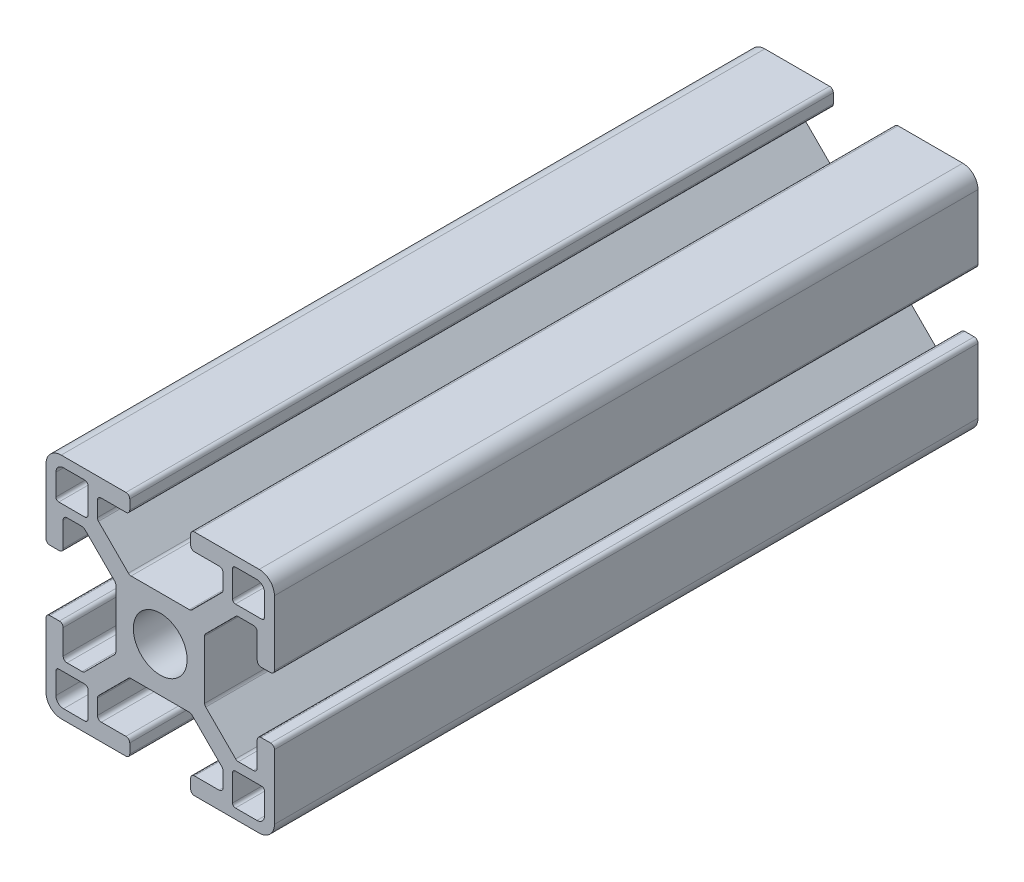
from build123d import *

# Parameters (mm, degrees)
SKETCH1_R           = 3.52998588
BOSS_EXTRUDE1_DEPTH = 46.2


with BuildPart() as part:
    # Sketch1 → Boss-Extrude1 (new, symmetric)
    with BuildSketch(Plane.XY):
        with BuildLine():
            Line((14.49994, -4), (13.24247465, -4))
            ThreePointArc((13.24247465, -4), (12.88892126, -4.146446609), (12.74247465, -4.5))
            Line((12.74247465, -4.5), (12.74247465, -7.732519321))
            ThreePointArc((12.74247465, -7.732519321), (12.602449697, -8.097296796), (12.242781236, -8.249967))
            Line((12.242781236, -8.249967), (10.260188032, -8.249967))
            ThreePointArc((10.260188032, -8.249967), (10.068847082, -8.211906919), (9.906636056, -8.103520976))
            Line((9.906636056, -8.103520976), (5.981117769, -4.178002689))
            ThreePointArc((5.981117769, -4.178002689), (5.872731827, -4.015791664), (5.834671745, -3.824450713))
            Line((5.834671745, -3.824450713), (5.834671745, -1.01249595))
            Line((5.834671745, -1.01249595), (5.834671745, 0.88749645))
            Line((5.834671745, 0.88749645), (5.834671745, 3.824450713))
            ThreePointArc((5.834671745, 3.824450713), (5.872731827, 4.015791664), (5.981117769, 4.178002689))
            Line((5.981117769, 4.178002689), (9.906636056, 8.103520976))
            ThreePointArc((9.906636056, 8.103520976), (10.068847082, 8.211906919), (10.260188032, 8.249967))
            Line((10.260188032, 8.249967), (12.242781236, 8.249967))
            ThreePointArc((12.242781236, 8.249967), (12.602449697, 8.097296796), (12.74247465, 7.732519321))
            Line((12.74247465, 7.732519321), (12.74247465, 4.5))
            ThreePointArc((12.74247465, 4.5), (12.88892126, 4.146446609), (13.24247465, 4))
            Line((13.24247465, 4), (14.49994, 4))
            ThreePointArc((14.49994, 4), (14.853493391, 4.146446609), (14.99994, 4.5))
            Line((14.99994, 4.5), (14.99994, 12.999948))
            ThreePointArc((14.99994, 12.999948), (14.414155906, 14.414155906), (12.999948, 14.99994))
            Line((12.999948, 14.99994), (4.5, 14.99994))
            ThreePointArc((4.5, 14.99994), (4.146446609, 14.853493391), (4, 14.49994))
            Line((4, 14.49994), (4, 13.24247465))
            ThreePointArc((4, 13.24247465), (4.146446609, 12.88892126), (4.5, 12.74247465))
            Line((4.5, 12.74247465), (7.732519321, 12.74247465))
            ThreePointArc((7.732519321, 12.74247465), (8.097296796, 12.602449697), (8.249967, 12.242781236))
            Line((8.249967, 12.242781236), (8.249967, 10.260188032))
            ThreePointArc((8.249967, 10.260188032), (8.211906919, 10.068847082), (8.103520976, 9.906636056))
            Line((8.103520976, 9.906636056), (4.178002689, 5.981117769))
            ThreePointArc((4.178002689, 5.981117769), (4.015791664, 5.872731827), (3.824450713, 5.834671745))
            Line((3.824450713, 5.834671745), (0.9499962, 5.834671745))
            Line((0.9499962, 5.834671745), (-0.9499962, 5.834671745))
            Line((-0.9499962, 5.834671745), (-3.824450713, 5.834671745))
            ThreePointArc((-3.824450713, 5.834671745), (-4.015791664, 5.872731827), (-4.178002689, 5.981117769))
            Line((-4.178002689, 5.981117769), (-8.103520976, 9.906636056))
            ThreePointArc((-8.103520976, 9.906636056), (-8.211906919, 10.068847082), (-8.249967, 10.260188032))
            Line((-8.249967, 10.260188032), (-8.249967, 12.242781236))
            ThreePointArc((-8.249967, 12.242781236), (-8.097296796, 12.602449697), (-7.732519321, 12.74247465))
            Line((-7.732519321, 12.74247465), (-4.5, 12.74247465))
            ThreePointArc((-4.5, 12.74247465), (-4.146446609, 12.88892126), (-4, 13.24247465))
            Line((-4, 13.24247465), (-4, 14.49994))
            ThreePointArc((-4, 14.49994), (-4.146446609, 14.853493391), (-4.5, 14.99994))
            Line((-4.5, 14.99994), (-12.999948, 14.99994))
            ThreePointArc((-12.999948, 14.99994), (-14.414155906, 14.414155906), (-14.99994, 12.999948))
            Line((-14.99994, 12.999948), (-14.99994, 4.5))
            ThreePointArc((-14.99994, 4.5), (-14.853493391, 4.146446609), (-14.49994, 4))
            Line((-14.49994, 4), (-13.24247465, 4))
            ThreePointArc((-13.24247465, 4), (-12.88892126, 4.146446609), (-12.74247465, 4.5))
            Line((-12.74247465, 4.5), (-12.74247465, 7.732519321))
            ThreePointArc((-12.74247465, 7.732519321), (-12.602449697, 8.097296796), (-12.242781236, 8.249967))
            Line((-12.242781236, 8.249967), (-10.260188032, 8.249967))
            ThreePointArc((-10.260188032, 8.249967), (-10.068847082, 8.211906919), (-9.906636056, 8.103520976))
            Line((-9.906636056, 8.103520976), (-5.981117769, 4.178002689))
            ThreePointArc((-5.981117769, 4.178002689), (-5.872731827, 4.015791664), (-5.834671745, 3.824450713))
            Line((-5.834671745, 3.824450713), (-5.834671745, 0.88749645))
            Line((-5.834671745, 0.88749645), (-5.834671745, -1.01249595))
            Line((-5.834671745, -1.01249595), (-5.834671745, -3.824450713))
            ThreePointArc((-5.834671745, -3.824450713), (-5.872731827, -4.015791664), (-5.981117769, -4.178002689))
            Line((-5.981117769, -4.178002689), (-9.906636056, -8.103520976))
            ThreePointArc((-9.906636056, -8.103520976), (-10.068847082, -8.211906919), (-10.260188032, -8.249967))
            Line((-10.260188032, -8.249967), (-12.242781236, -8.249967))
            ThreePointArc((-12.242781236, -8.249967), (-12.602449697, -8.097296796), (-12.74247465, -7.732519321))
            Line((-12.74247465, -7.732519321), (-12.74247465, -4.5))
            ThreePointArc((-12.74247465, -4.5), (-12.88892126, -4.146446609), (-13.24247465, -4))
            Line((-13.24247465, -4), (-14.49994, -4))
            ThreePointArc((-14.49994, -4), (-14.853493391, -4.146446609), (-14.99994, -4.5))
            Line((-14.99994, -4.5), (-14.99994, -12.999948))
            ThreePointArc((-14.99994, -12.999948), (-14.414155906, -14.414155906), (-12.999948, -14.99994))
            Line((-12.999948, -14.99994), (-4.5, -14.99994))
            ThreePointArc((-4.5, -14.99994), (-4.146446609, -14.853493391), (-4, -14.49994))
            Line((-4, -14.49994), (-4, -13.24247465))
            ThreePointArc((-4, -13.24247465), (-4.146446609, -12.88892126), (-4.5, -12.74247465))
            Line((-4.5, -12.74247465), (-7.732519321, -12.74247465))
            ThreePointArc((-7.732519321, -12.74247465), (-8.097296796, -12.602449697), (-8.249967, -12.242781236))
            Line((-8.249967, -12.242781236), (-8.249967, -10.260188032))
            ThreePointArc((-8.249967, -10.260188032), (-8.211906919, -10.068847082), (-8.103520976, -9.906636056))
            Line((-8.103520976, -9.906636056), (-4.178002689, -5.981117769))
            ThreePointArc((-4.178002689, -5.981117769), (-4.015791664, -5.872731827), (-3.824450713, -5.834671745))
            Line((-3.824450713, -5.834671745), (-0.9499962, -5.834671745))
            Line((-0.9499962, -5.834671745), (0.9499962, -5.834671745))
            Line((0.9499962, -5.834671745), (3.824450713, -5.834671745))
            ThreePointArc((3.824450713, -5.834671745), (4.015791664, -5.872731827), (4.178002689, -5.981117769))
            Line((4.178002689, -5.981117769), (8.103520976, -9.906636056))
            ThreePointArc((8.103520976, -9.906636056), (8.211906919, -10.068847082), (8.249967, -10.260188032))
            Line((8.249967, -10.260188032), (8.249967, -12.242781236))
            ThreePointArc((8.249967, -12.242781236), (8.097296796, -12.602449697), (7.732519321, -12.74247465))
            Line((7.732519321, -12.74247465), (4.5, -12.74247465))
            ThreePointArc((4.5, -12.74247465), (4.146446609, -12.88892126), (4, -13.24247465))
            Line((4, -13.24247465), (4, -14.49994))
            ThreePointArc((4, -14.49994), (4.146446609, -14.853493391), (4.5, -14.99994))
            Line((4.5, -14.99994), (12.999948, -14.99994))
            ThreePointArc((12.999948, -14.99994), (14.414155906, -14.414155906), (14.99994, -12.999948))
            Line((14.99994, -12.999948), (14.99994, -4.5))
            ThreePointArc((14.99994, -4.5), (14.853493391, -4.146446609), (14.49994, -4))
        make_face()
        Circle(SKETCH1_R, mode=Mode.SUBTRACT)
        with BuildLine():
            Line((-12.6999492, -13.6999452), (-9.880960476, -13.6999452))
            ThreePointArc((-9.880960476, -13.6999452), (-9.61155387, -13.58835333), (-9.499962, -13.318946724))
            Line((-9.499962, -13.318946724), (-9.499962, -9.87996048))
            ThreePointArc((-9.499962, -9.87996048), (-9.611260978, -9.611260978), (-9.87996048, -9.499962))
            Line((-9.87996048, -9.499962), (-13.318946724, -9.499962))
            ThreePointArc((-13.318946724, -9.499962), (-13.58835333, -9.61155387), (-13.6999452, -9.880960476))
            Line((-13.6999452, -9.880960476), (-13.6999452, -12.6999492))
            ThreePointArc((-13.6999452, -12.6999492), (-13.407053153, -13.407053153), (-12.6999492, -13.6999452))
        make_face(mode=Mode.SUBTRACT)
        with BuildLine():
            Line((13.6999452, -12.6999492), (13.6999452, -9.880960476))
            ThreePointArc((13.6999452, -9.880960476), (13.58835333, -9.61155387), (13.318946724, -9.499962))
            Line((13.318946724, -9.499962), (9.87996048, -9.499962))
            ThreePointArc((9.87996048, -9.499962), (9.611260978, -9.611260978), (9.499962, -9.87996048))
            Line((9.499962, -9.87996048), (9.499962, -13.318946724))
            ThreePointArc((9.499962, -13.318946724), (9.61155387, -13.58835333), (9.880960476, -13.6999452))
            Line((9.880960476, -13.6999452), (12.6999492, -13.6999452))
            ThreePointArc((12.6999492, -13.6999452), (13.407053153, -13.407053153), (13.6999452, -12.6999492))
        make_face(mode=Mode.SUBTRACT)
        with BuildLine():
            Line((9.87996048, 9.499962), (13.318946724, 9.499962))
            ThreePointArc((13.318946724, 9.499962), (13.58835333, 9.61155387), (13.6999452, 9.880960476))
            Line((13.6999452, 9.880960476), (13.6999452, 12.6999492))
            ThreePointArc((13.6999452, 12.6999492), (13.407053153, 13.407053153), (12.6999492, 13.6999452))
            Line((12.6999492, 13.6999452), (9.880960476, 13.6999452))
            ThreePointArc((9.880960476, 13.6999452), (9.61155387, 13.58835333), (9.499962, 13.318946724))
            Line((9.499962, 13.318946724), (9.499962, 9.87996048))
            ThreePointArc((9.499962, 9.87996048), (9.611260978, 9.611260978), (9.87996048, 9.499962))
        make_face(mode=Mode.SUBTRACT)
        with BuildLine():
            Line((-13.6999452, 12.6999492), (-13.6999452, 9.880960476))
            ThreePointArc((-13.6999452, 9.880960476), (-13.58835333, 9.61155387), (-13.318946724, 9.499962))
            Line((-13.318946724, 9.499962), (-9.87996048, 9.499962))
            ThreePointArc((-9.87996048, 9.499962), (-9.611260978, 9.611260978), (-9.499962, 9.87996048))
            Line((-9.499962, 9.87996048), (-9.499962, 13.318946724))
            ThreePointArc((-9.499962, 13.318946724), (-9.61155387, 13.58835333), (-9.880960476, 13.6999452))
            Line((-9.880960476, 13.6999452), (-12.6999492, 13.6999452))
            ThreePointArc((-12.6999492, 13.6999452), (-13.407053153, 13.407053153), (-13.6999452, 12.6999492))
        make_face(mode=Mode.SUBTRACT)
    extrude(amount=BOSS_EXTRUDE1_DEPTH, both=True)


solid = part.part
